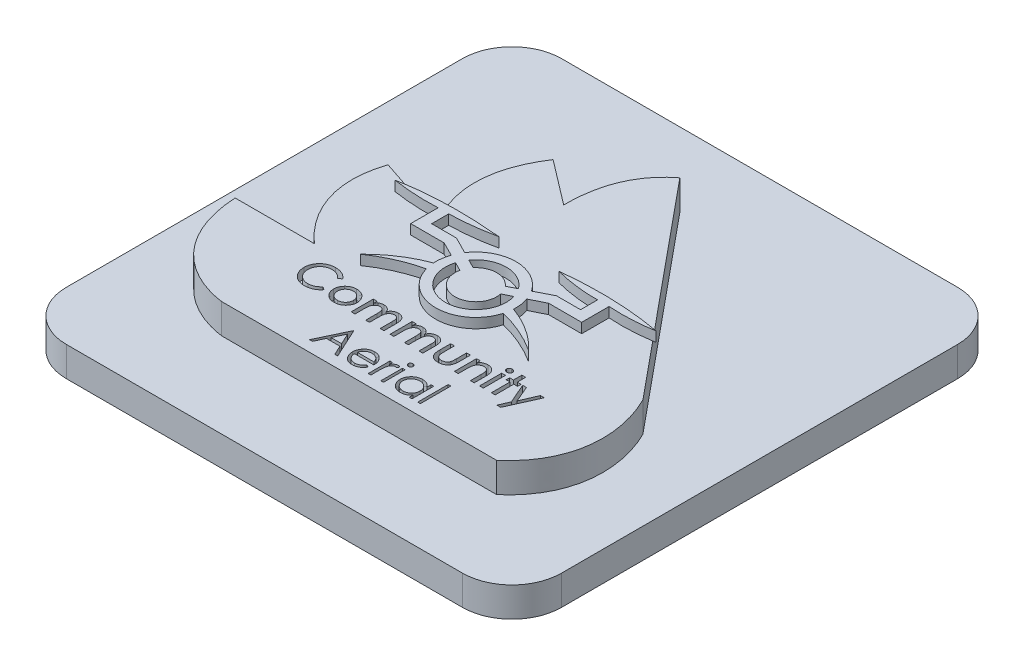
from build123d import *

# Parameters (mm, degrees)
SALIENTE_EXTRUIR1_DEPTH = 3
SALIENTE_EXTRUIR2_DEPTH = 3
SALIENTE_EXTRUIR3_DEPTH = 1
CROQUIS9_W              = 0.384615384
CROQUIS9_H              = 2.230769231
CROQUIS9_W_2            = 0.269230769
CROQUIS9_H_2            = 2.192307693
CROQUIS9_H_3            = 3.076923077
CORTAR_EXTRUIR1_DEPTH   = 1


with BuildPart() as part:
    # Croquis1 → Saliente-Extruir1 (new body)
    with BuildSketch(Plane(origin=(0, 0, 0), x_dir=(1, 0, 0), z_dir=(0, 1, 0))):
        with BuildLine():
            Line((-20, -25), (20, -25))
            ThreePointArc((20, -25), (23.535533906, -23.535533906), (25, -20))
            Line((25, -20), (25, 20))
            ThreePointArc((25, 20), (23.535533906, 23.535533906), (20, 25))
            Line((20, 25), (-20, 25))
            ThreePointArc((-20, 25), (-23.535533906, 23.535533906), (-25, 20))
            Line((-25, 20), (-25, -20))
            ThreePointArc((-25, -20), (-23.535533906, -23.535533906), (-20, -25))
        make_face()
    extrude(amount=SALIENTE_EXTRUIR1_DEPTH)

    # Croquis6 → Saliente-Extruir2 (add)
    with BuildSketch(Plane(origin=(0, 3, 0), x_dir=(1, 0, 0), z_dir=(0, 1, 0))):
        with BuildLine():
            Line((-0.595503629, 17.549236711), (16.965142917, -3.747013148))
            add(Edge.make_bspline(
                [(16.965142917, -3.747013148), (18.872094084, -7.577379746), (19.162143523, -12.703879642), (14.864425621, -16.410366815)],
                knots=[0, 0, 0, 0, 1, 1, 1, 1], degree=3))
            Line((14.864425621, -16.410366815), (-12.915167166, -16.410366815))
            add(Edge.make_bspline(
                [(-12.915167166, -16.410366815), (-17.156158437, -15.818213248), (-20.9540575, -12.712422517), (-21.289806242, -6.66894517)],
                knots=[0, 0, 0, 0, 1, 1, 1, 1], degree=3))
            Line((-21.289806242, -6.66894517), (-13.274385006, -6.66894517))
            add(Edge.make_bspline(
                [(-13.274385006, -6.66894517), (-16.066037219, -4.244615616), (-17.958071864, -0.509342383), (-16.470718627, 3.952717326)],
                knots=[0, 0, 0, 0, 1, 1, 1, 1], degree=3))
            Line((-16.470718627, 3.952717326), (-8.845133153, 1.410855502))
            add(Edge.make_bspline(
                [(-8.845133153, 1.410855502), (-10.96469575, 4.53759804), (-11.330230032, 8.577654893), (-8.59108015, 12.740331995)],
                knots=[0, 0, 0, 0, 1, 1, 1, 1], degree=3))
            Line((-8.59108015, 12.740331995), (-4.083809752, 9.30414951))
            add(Edge.make_bspline(
                [(-4.083809752, 9.30414951), (-4.143667903, 14.820140537), (-0.595503629, 17.549236711)],
                knots=[0, 0, 0, 1, 1, 1], degree=2))
        make_face()
    extrude(amount=SALIENTE_EXTRUIR2_DEPTH)

    # Croquis8 → Saliente-Extruir3 (add)
    with BuildSketch(Plane(origin=(0, 6, 0), x_dir=(1, 0, 0), z_dir=(0, 1, 0))):
        with BuildLine():
            Line((4.752382461, -1.0473555), (3.27665913, -1.777444063))
            ThreePointArc((3.27665913, -1.777444063), (3.461184382, -2.545877663), (3.492924377, -3.335518302))
            add(Edge.make_bspline(
                [(3.492924377, -3.335518302), (6.086272648, -4.275160549), (7.866274911, -6.18313683)],
                knots=[0, 0, 0, 1, 1, 1], degree=2))
            add(Edge.make_bspline(
                [(3.342436036, -4.219780416), (5.735806779, -4.812863994), (7.866274911, -6.18313683)],
                knots=[0, 0, 0, 1, 1, 1], degree=2))
            ThreePointArc((3.342436036, -4.219780416), (-0.549246204, -7.151416377), (-4.440928444, -4.219780416))
            add(Edge.make_bspline(
                [(-4.440928444, -4.219780416), (-6.897374715, -4.776442922), (-9.048256707, -6.256574953)],
                knots=[0, 0, 0, 1, 1, 1], degree=2))
            add(Edge.make_bspline(
                [(-9.048256707, -6.256574953), (-7.086513426, -4.270125847), (-4.591416785, -3.335518302)],
                knots=[0, 0, 0, 1, 1, 1], degree=2))
            ThreePointArc((-4.591416785, -3.335518302), (-4.558844686, -2.539915359), (-4.37119419, -1.766072819))
            Line((-4.37119419, -1.766072819), (-5.802037659, -1.0473555))
            Line((-5.802037659, -1.0473555), (-9.183733575, -1.0473555))
            Line((-9.183733575, -1.0473555), (-9.183733575, 1.721507307))
            add(Edge.make_bspline(
                [(-9.183733575, 1.721507307), (-11.418491387, 1.602185371), (-13.770091581, 1.958048543)],
                knots=[0, 0, 0, 1, 1, 1], degree=2))
            add(Edge.make_bspline(
                [(-13.770091581, 1.958048543), (-10.390702964, 2.616371001), (-6.970911969, 2.565850287), (-3.589204361, 2.263912107)],
                knots=[0, 0, 0, 0, 1, 1, 1, 1], degree=3))
            add(Edge.make_bspline(
                [(-8.114971612, 1.721507307), (-5.815935606, 1.778256872), (-3.589204361, 2.263912107)],
                knots=[0, 0, 0, 1, 1, 1], degree=2))
            Line((-8.114971612, 1.721507307), (-8.114971612, 0))
            Line((-8.114971612, 0), (-5.601123051, 0))
            Line((-5.601123051, 0), (-3.919535783, -0.858752061))
            ThreePointArc((-3.919535783, -0.858752061), (-0.5513851, 0.946341572), (2.818670851, -0.855192476))
            Line((2.818670851, -0.855192476), (4.484377163, 0))
            Line((4.484377163, 0), (6.922960797, 0))
            Line((6.922960797, 0), (6.922960797, 1.721507307))
            add(Edge.make_bspline(
                [(6.922960797, 1.721507307), (4.689578848, 1.689604155), (2.488792555, 2.263912107)],
                knots=[0, 0, 0, 1, 1, 1], degree=2))
            add(Edge.make_bspline(
                [(2.488792555, 2.263912107), (7.62426283, 2.858478497), (12.602813944, 1.958048543)],
                knots=[0, 0, 0, 1, 1, 1], degree=2))
            add(Edge.make_bspline(
                [(12.602813944, 1.958048543), (10.372802055, 1.570256513), (8.082040673, 1.721507307)],
                knots=[0, 0, 0, 1, 1, 1], degree=2))
            Line((8.082040673, 1.721507307), (8.082040673, -1.0473555))
            Line((8.082040673, -1.0473555), (4.752382461, -1.0473555))
        make_face()
        with BuildLine():
            Line((-3.496363092, -2.20550332), (-2.610549432, -2.650450397))
            ThreePointArc((-2.610549432, -2.650450397), (-0.549246204, -5.212834115), (1.512057025, -2.650450397))
            Line((1.512057025, -2.650450397), (2.399639249, -2.211334462))
            ThreePointArc((2.399639249, -2.211334462), (-0.552292925, -6.183147175), (-3.496363092, -2.20550332))
        make_face(mode=Mode.SUBTRACT)
        with BuildLine():
            Line((-3.049614918, -1.303002769), (-2.170673172, -1.751860256))
            ThreePointArc((-2.170673172, -1.751860256), (-0.549246204, -0.992240125), (1.072180764, -1.751860256))
            Line((1.072180764, -1.751860256), (1.949859966, -1.301249819))
            ThreePointArc((1.949859966, -1.301249819), (-0.550326349, -0.021925748), (-3.049614918, -1.303002769))
        make_face(mode=Mode.SUBTRACT)
    extrude(amount=SALIENTE_EXTRUIR3_DEPTH)

    # Croquis9 → Cortar-Extruir1 (cut)
    # profile 1 of 17: a face of its own
    with BuildSketch(Plane(origin=(0, 6, 0), x_dir=(1, 0, 0), z_dir=(0, 1, 0))):
        with BuildLine():
            Line((-8.780017609, -8.323441804), (-9.086507994, -8.534980265))
            add(Edge.make_bspline(
                [(-9.086507994, -8.534980265), (-9.123216671, -8.494771362), (-9.195078289, -8.416057635), (-9.313416623, -8.312947509), (-9.437262649, -8.22616417), (-9.566790752, -8.155996545), (-9.702138073, -8.101066412), (-9.844016551, -8.062899151), (-9.992574412, -8.03937753), (-10.093831734, -8.036464086), (-10.145402225, -8.034980265)],
                knots=[0, 0, 0, 0, 1.078723025, 2.111729107, 3.104379151, 4.071093171, 5.02612831, 5.993405043, 6.978038489, 8, 8, 8, 8], degree=3))
            add(Edge.make_bspline(
                [(-10.145402225, -8.034980265), (-10.17226811, -8.035367503), (-10.225715091, -8.036137874), (-10.304917223, -8.044607563), (-10.382907901, -8.056200203), (-10.459613748, -8.073814024), (-10.534898494, -8.096840804), (-10.609275096, -8.123544869), (-10.681617206, -8.156620514), (-10.752626601, -8.193383886), (-10.821237845, -8.234734533), (-10.885863543, -8.280661792), (-10.947679471, -8.329113469), (-11.004937994, -8.382380364), (-11.05816164, -8.439527623), (-11.108516289, -8.499836097), (-11.154729228, -8.564090228), (-11.196622829, -8.632097388), (-11.2348362, -8.702844289), (-11.266905421, -8.776849442), (-11.294747575, -8.85285741), (-11.31785281, -8.931263977), (-11.334941599, -9.012306635), (-11.347612698, -9.095764785), (-11.355732748, -9.181453568), (-11.356535762, -9.239489416), (-11.356940686, -9.268754304)],
                knots=[0, 0, 0, 0, 1.002068956, 1.993515617, 2.969284448, 3.943018425, 4.926742606, 5.905741285, 6.889351865, 7.892340394, 8.888397413, 9.875523532, 10.849114049, 11.817064186, 12.790109362, 13.76151668, 14.746886598, 15.740472426, 16.740336546, 17.744438579, 18.747064952, 19.759451636, 20.791569268, 21.834966327, 22.908270136, 24, 24, 24, 24], degree=3))
            add(Edge.make_bspline(
                [(-11.356940686, -9.268754304), (-11.35601365, -9.312684206), (-11.354198949, -9.398678325), (-11.33665886, -9.524595348), (-11.309290129, -9.644589886), (-11.270817948, -9.758652461), (-11.221107333, -9.866653498), (-11.160290602, -9.968415564), (-11.088017796, -10.064186784), (-11.005487038, -10.152729244), (-10.915520715, -10.233988377), (-10.818013468, -10.303512788), (-10.71630427, -10.363885577), (-10.608382923, -10.411821013), (-10.495774442, -10.44994477), (-10.377607302, -10.476950172), (-10.254248566, -10.493519794), (-10.170093913, -10.495508947), (-10.127373379, -10.496518727)],
                knots=[0, 0, 0, 0, 1.083728652, 2.12143175, 3.131304262, 4.117911469, 5.086904967, 6.060353746, 7.03835, 8.042493243, 9.043967071, 10.025107856, 10.993520914, 11.958418665, 12.934074928, 13.923564625, 14.94591178, 16, 16, 16, 16], degree=3))
            add(Edge.make_bspline(
                [(-10.127373379, -10.496518727), (-10.077799092, -10.495061476), (-9.979886692, -10.492183313), (-9.835918691, -10.467940419), (-9.69720191, -10.428783864), (-9.563586576, -10.373585333), (-9.434963631, -10.302887199), (-9.311937323, -10.216145868), (-9.193821994, -10.114145698), (-9.122027671, -10.03632349), (-9.085306071, -9.996518727)],
                knots=[0, 0, 0, 0, 0.996377973, 1.967910503, 2.926842387, 3.889624876, 4.868586907, 5.872161968, 6.91164629, 8, 8, 8, 8], degree=3))
            Line((-9.085306071, -9.996518727), (-8.780017609, -10.206855265))
            add(Edge.make_bspline(
                [(-8.780017609, -10.206855265), (-8.799780676, -10.231918179), (-8.839047319, -10.281714931), (-8.902460012, -10.352150505), (-8.969067092, -10.418394883), (-9.039524469, -10.47983361), (-9.113756762, -10.536406926), (-9.191416158, -10.588769891), (-9.272428032, -10.636839219), (-9.356748124, -10.680100535), (-9.443896069, -10.71881997), (-9.534049797, -10.751426269), (-9.626345274, -10.780190366), (-9.721596312, -10.80270947), (-9.819431072, -10.82096057), (-9.920001078, -10.833210813), (-10.022866582, -10.841502259), (-10.092300531, -10.842279812), (-10.127373379, -10.842672573)],
                knots=[0, 0, 0, 0, 0.990136069, 1.967271632, 2.938597646, 3.903378639, 4.8655934, 5.832714132, 6.808088679, 7.786607084, 8.77175572, 9.76479442, 10.759640537, 11.769709565, 12.799869661, 13.846050076, 14.911985293, 16, 16, 16, 16], degree=3))
            add(Edge.make_bspline(
                [(-10.127373379, -10.842672573), (-10.159639724, -10.842453903), (-10.223242543, -10.842022865), (-10.317237945, -10.834780626), (-10.408742518, -10.824987439), (-10.497509613, -10.81029528), (-10.583958092, -10.792701209), (-10.667382335, -10.769373567), (-10.748914173, -10.743351969), (-10.827367313, -10.711882482), (-10.903333288, -10.676886868), (-10.977079336, -10.638532283), (-11.047879945, -10.595256384), (-11.115794048, -10.547479489), (-11.181621046, -10.496404347), (-11.244695172, -10.440893753), (-11.305672694, -10.381654588), (-11.343387202, -10.338918888), (-11.36234934, -10.317432188)],
                knots=[0, 0, 0, 0, 1.116169561, 2.200172621, 3.260333751, 4.299600589, 5.312386579, 6.311224183, 7.295427787, 8.272379731, 9.233840239, 10.188782295, 11.146938977, 12.102635432, 13.060741968, 14.028403985, 15.00871894, 16, 16, 16, 16], degree=3))
            add(Edge.make_bspline(
                [(-11.36234934, -10.317432188), (-11.392746353, -10.28012577), (-11.452998288, -10.206178242), (-11.529790339, -10.085980448), (-11.596025452, -9.96087943), (-11.648651873, -9.82909281), (-11.690248858, -9.692174815), (-11.720567279, -9.549707658), (-11.738036351, -9.401204006), (-11.740369724, -9.300250148), (-11.741556071, -9.248922573)],
                knots=[0, 0, 0, 0, 0.995996121, 1.974230005, 2.94855815, 3.923972302, 4.908363682, 5.909282248, 6.937024559, 8, 8, 8, 8], degree=3))
            add(Edge.make_bspline(
                [(-11.741556071, -9.248922573), (-11.740216738, -9.194963238), (-11.737581684, -9.088801614), (-11.715389632, -8.932959943), (-11.679230419, -8.783882255), (-11.629530533, -8.640925245), (-11.563673092, -8.505258517), (-11.485134432, -8.375128977), (-11.390154065, -8.252961274), (-11.283405928, -8.137697477), (-11.165960628, -8.032210499), (-11.03912857, -7.940736228), (-10.905618228, -7.862566887), (-10.764937921, -7.798531895), (-10.61670646, -7.748925235), (-10.461168899, -7.714607113), (-10.298658732, -7.692876738), (-10.187940187, -7.6901927), (-10.131580109, -7.688826419)],
                knots=[0, 0, 0, 0, 1.034323922, 2.034967744, 3.011348252, 3.972313581, 4.931003742, 5.898099022, 6.881526582, 7.89265862, 8.907395938, 9.903191422, 10.886146247, 11.869423756, 12.861842533, 13.877618994, 14.91962492, 16, 16, 16, 16], degree=3))
            add(Edge.make_bspline(
                [(-10.131580109, -7.688826419), (-10.096109008, -7.68923714), (-10.02587954, -7.690050328), (-9.92175631, -7.698085011), (-9.820275426, -7.711273198), (-9.721416623, -7.729439294), (-9.624887294, -7.751887159), (-9.531198318, -7.781157268), (-9.439818822, -7.814594629), (-9.351363905, -7.853199763), (-9.266050625, -7.896146134), (-9.184846193, -7.944595142), (-9.107189503, -7.996687299), (-9.033699549, -8.053508373), (-8.963886506, -8.114121499), (-8.898091329, -8.179224332), (-8.836656821, -8.249080902), (-8.79896056, -8.298571845), (-8.780017609, -8.323441804)],
                knots=[0, 0, 0, 0, 1.097463626, 2.172875475, 3.229307817, 4.262776093, 5.282168658, 6.293918414, 7.298043722, 8.291879901, 9.278790577, 10.251524626, 11.216027204, 12.170719329, 13.124142787, 14.075306658, 15.032812027, 16, 16, 16, 16], degree=3))
        make_face()
    # profile 2 of 17: a face of its own
    with BuildSketch(Plane(origin=(0, 6, 0), x_dir=(1, 0, 0), z_dir=(0, 1, 0))):
        with BuildLine():
            add(Edge.make_bspline(
                [(-7.18266184, -8.496518727), (-7.138141889, -8.4977379), (-7.050980228, -8.500124811), (-6.923439736, -8.516917861), (-6.802327086, -8.546095217), (-6.687295159, -8.586029752), (-6.578817369, -8.638349564), (-6.476622777, -8.7016475), (-6.381076755, -8.777154363), (-6.323523405, -8.835051), (-6.294440686, -8.864307188)],
                knots=[0, 0, 0, 0, 1.078775739, 2.112039281, 3.110494877, 4.093081892, 5.057110616, 6.022958758, 7.000966324, 8, 8, 8, 8], degree=3))
            add(Edge.make_bspline(
                [(-6.294440686, -8.864307188), (-6.268650233, -8.893305251), (-6.217944192, -8.950317704), (-6.152426495, -9.042281496), (-6.096630139, -9.136883691), (-6.051489389, -9.234837496), (-6.015508951, -9.335694987), (-5.990556256, -9.439854686), (-5.974842934, -9.547119543), (-5.973171314, -9.619661016), (-5.972325302, -9.656374496)],
                knots=[0, 0, 0, 0, 1.062178036, 2.088324843, 3.086640365, 4.066023852, 5.037709567, 6.014384934, 6.995073642, 8, 8, 8, 8], degree=3))
            add(Edge.make_bspline(
                [(-5.972325302, -9.656374496), (-5.973382694, -9.693290557), (-5.975478299, -9.766453059), (-5.991699485, -9.874529672), (-6.017353586, -9.979727549), (-6.054257714, -10.081566431), (-6.101752463, -10.180156815), (-6.158731686, -10.276098421), (-6.227430341, -10.36811429), (-6.304671685, -10.456471213), (-6.39050869, -10.537984264), (-6.48418532, -10.609348161), (-6.584553176, -10.669741012), (-6.691431025, -10.719452663), (-6.805328582, -10.757016462), (-6.925142497, -10.784834803), (-7.05179713, -10.80126333), (-7.138342544, -10.80321275), (-7.18266184, -10.804211034)],
                knots=[0, 0, 0, 0, 0.952871876, 1.888459614, 2.815544184, 3.744891397, 4.679563604, 5.637601804, 6.621431805, 7.640342292, 8.664856555, 9.672479278, 10.67487095, 11.683873433, 12.709444777, 13.765907845, 14.855937143, 16, 16, 16, 16], degree=3))
            add(Edge.make_bspline(
                [(-7.18266184, -10.804211034), (-7.224988738, -10.803238869), (-7.307961711, -10.801333145), (-7.429210602, -10.784414477), (-7.544830347, -10.758594682), (-7.653977766, -10.720182381), (-7.757552009, -10.672147045), (-7.854860212, -10.612568761), (-7.946651882, -10.542864944), (-8.030532541, -10.462217281), (-8.10698733, -10.375518149), (-8.173348864, -10.283475517), (-8.230426037, -10.188229287), (-8.276828956, -10.088973816), (-8.31238818, -9.98574479), (-8.338424381, -9.879394099), (-8.353628451, -9.768991509), (-8.355825795, -9.694281129), (-8.356940686, -9.656374496)],
                knots=[0, 0, 0, 0, 1.108842573, 2.173652473, 3.202745058, 4.208988794, 5.200203338, 6.189803525, 7.193715926, 8.215010613, 9.234454675, 10.219573757, 11.184848795, 12.140854958, 13.08565054, 14.042002664, 15.006549187, 16, 16, 16, 16], degree=3))
            add(Edge.make_bspline(
                [(-8.356940686, -9.656374496), (-8.356032661, -9.618870569), (-8.354243672, -9.54498041), (-8.339578728, -9.436031243), (-8.31469686, -9.331347047), (-8.281154333, -9.230080626), (-8.236861623, -9.133003038), (-8.183013094, -9.039566503), (-8.120095704, -8.949426036), (-8.071050697, -8.894096124), (-8.046243571, -8.866110073)],
                knots=[0, 0, 0, 0, 1.034079547, 2.037341334, 3.024980457, 3.998111168, 4.974764182, 5.962233312, 6.969290918, 8, 8, 8, 8], degree=3))
            add(Edge.make_bspline(
                [(-8.046243571, -8.866110073), (-8.017384405, -8.836629739), (-7.960490217, -8.778510955), (-7.865790529, -8.70316005), (-7.765877442, -8.63891334), (-7.659745763, -8.587252089), (-7.548634118, -8.545743656), (-7.431450794, -8.51713622), (-7.308763629, -8.500129671), (-7.22518422, -8.497736362), (-7.18266184, -8.496518727)],
                knots=[0, 0, 0, 0, 1.021997278, 2.014808882, 2.992991082, 3.961403697, 4.935644248, 5.92819495, 6.945935601, 8, 8, 8, 8], degree=3))
        make_face()
        with BuildLine():
            add(Edge.make_bspline(
                [(-7.183863763, -8.842672573), (-7.209543196, -8.843356852), (-7.260531079, -8.844715526), (-7.335632057, -8.855833448), (-7.40862688, -8.873812149), (-7.478714549, -8.899914169), (-7.546952974, -8.932533815), (-7.612195333, -8.973162926), (-7.675912008, -9.020152601), (-7.735783407, -9.074565378), (-7.791487769, -9.133801637), (-7.839751095, -9.198041388), (-7.88103902, -9.265483488), (-7.91410461, -9.336979227), (-7.940230298, -9.412043265), (-7.958510832, -9.49081983), (-7.970559622, -9.573271851), (-7.971728676, -9.629487663), (-7.972325302, -9.65817738)],
                knots=[0, 0, 0, 0, 0.976916649, 1.939720157, 2.882730922, 3.833047911, 4.780976627, 5.756404754, 6.753607, 7.790049989, 8.831165002, 9.84360893, 10.842529111, 11.835057585, 12.835634664, 13.861933882, 14.908838789, 16, 16, 16, 16], degree=3))
            add(Edge.make_bspline(
                [(-7.972325302, -9.65817738), (-7.970959252, -9.69554293), (-7.96827083, -9.769079324), (-7.946302535, -9.876791459), (-7.911437675, -9.979732009), (-7.862759103, -10.076557763), (-7.803251054, -10.165142052), (-7.73388513, -10.242692759), (-7.657313591, -10.309827198), (-7.572058126, -10.363738701), (-7.481041812, -10.405934699), (-7.38549649, -10.435974339), (-7.285960928, -10.454748538), (-7.218201579, -10.456944407), (-7.183863763, -10.458057188)],
                knots=[0, 0, 0, 0, 1.073737222, 2.11314337, 3.147909503, 4.191315005, 5.220292011, 6.207728104, 7.175628903, 8.139268678, 9.098074859, 10.052770626, 11.013219503, 12, 12, 12, 12], degree=3))
            add(Edge.make_bspline(
                [(-7.183863763, -10.458057188), (-7.146718359, -10.45678802), (-7.073521375, -10.454287058), (-6.966314336, -10.434409724), (-6.86393185, -10.402494376), (-6.767091322, -10.358013698), (-6.677218247, -10.301662761), (-6.596852849, -10.233272148), (-6.526419493, -10.153975663), (-6.466110781, -10.065587466), (-6.417408912, -9.969685815), (-6.382443601, -9.869037293), (-6.361235252, -9.764628093), (-6.358383141, -9.693931956), (-6.356940686, -9.65817738)],
                knots=[0, 0, 0, 0, 1.042880454, 2.055051067, 3.051726387, 4.048830532, 5.040201766, 6.022282375, 7.002717173, 8.011000956, 9.020163719, 10.014978664, 10.996075346, 12, 12, 12, 12], degree=3))
            add(Edge.make_bspline(
                [(-6.356940686, -9.65817738), (-6.35756745, -9.630492366), (-6.358803825, -9.575879968), (-6.370604384, -9.495530031), (-6.389756466, -9.418159682), (-6.416971955, -9.344114476), (-6.451436226, -9.273136833), (-6.493840266, -9.205529335), (-6.544033842, -9.140969721), (-6.601253426, -9.080502871), (-6.663279915, -9.0249063), (-6.728818958, -8.975808077), (-6.797736056, -8.935030269), (-6.869076008, -8.900666415), (-6.943845132, -8.875131031), (-7.021275027, -8.856423446), (-7.101563451, -8.844511199), (-7.156177774, -8.84329109), (-7.183863763, -8.842672573)],
                knots=[0, 0, 0, 0, 1.02928639, 2.030405262, 3.013559112, 3.98951401, 4.959304921, 5.943474834, 6.952548865, 7.996299005, 9.035918103, 10.047849461, 11.03697177, 12.01024899, 12.98822153, 13.969594738, 14.97071361, 16, 16, 16, 16], degree=3))
        make_face(mode=Mode.SUBTRACT)
    # profile 3 of 17: a face of its own
    with BuildSketch(Plane(origin=(0, 6, 0), x_dir=(1, 0, 0), z_dir=(0, 1, 0))):
        with BuildLine():
            Line((-5.472325302, -8.534980265), (-5.087709917, -8.534980265))
            Line((-5.087709917, -8.534980265), (-5.087709917, -8.909379304))
            add(Edge.make_bspline(
                [(-5.087709917, -8.909379304), (-5.084016013, -8.89326829), (-5.076808613, -8.861833121), (-5.060937764, -8.816973874), (-5.04154889, -8.775492132), (-5.019481438, -8.736396703), (-4.992665946, -8.701204043), (-4.963333613, -8.668132788), (-4.929374477, -8.63939978), (-4.904771522, -8.622704242), (-4.892397417, -8.614307188)],
                knots=[0, 0, 0, 0, 1.08898891, 2.124791909, 3.129224238, 4.105481065, 5.077441123, 6.040388005, 7.014409297, 8, 8, 8, 8], degree=3))
            add(Edge.make_bspline(
                [(-4.892397417, -8.614307188), (-4.855151485, -8.596061415), (-4.781610758, -8.560035805), (-4.665298475, -8.524250055), (-4.547623494, -8.500407475), (-4.468235826, -8.497816866), (-4.428455109, -8.496518727)],
                knots=[0, 0, 0, 0, 1.028471117, 2.030678542, 3.013184023, 4, 4, 4, 4], degree=3))
            add(Edge.make_bspline(
                [(-4.428455109, -8.496518727), (-4.399157144, -8.497264885), (-4.341057022, -8.498744575), (-4.255028739, -8.512539941), (-4.171477044, -8.534715387), (-4.091189939, -8.56532078), (-4.016290312, -8.602873282), (-3.947905248, -8.645305959), (-3.88770983, -8.693409551), (-3.834930045, -8.74607896), (-3.79107363, -8.805128757), (-3.756490052, -8.869788663), (-3.731955536, -8.940864482), (-3.723606506, -8.990744389), (-3.719320494, -9.016350457)],
                knots=[0, 0, 0, 0, 1.099015544, 2.179432478, 3.260947688, 4.338981182, 5.398181099, 6.40160478, 7.353922011, 8.284349489, 9.192639792, 10.104191918, 11.026778618, 12, 12, 12, 12], degree=3))
            add(Edge.make_bspline(
                [(-3.719320494, -9.016350457), (-3.712378721, -8.996617451), (-3.698652022, -8.9575973), (-3.673550861, -8.901382284), (-3.643144338, -8.848912433), (-3.60875851, -8.799486659), (-3.570385362, -8.752800704), (-3.52665645, -8.710479702), (-3.479812338, -8.67016184), (-3.428154325, -8.634819581), (-3.37442073, -8.602398866), (-3.318976893, -8.574135021), (-3.26265783, -8.549912203), (-3.205009692, -8.530878309), (-3.146772541, -8.514858284), (-3.08704638, -8.504083148), (-3.02632974, -8.498216478), (-2.985558114, -8.497085726), (-2.965113763, -8.496518727)],
                knots=[0, 0, 0, 0, 1.024672991, 2.026193794, 3.01103273, 3.991165591, 4.973850373, 5.96628909, 6.969107479, 7.9982829, 9.028393851, 10.042340945, 11.044967205, 12.028827566, 13.014448664, 14.002022455, 14.998142625, 16, 16, 16, 16], degree=3))
            add(Edge.make_bspline(
                [(-2.965113763, -8.496518727), (-2.944263083, -8.496791748), (-2.903272055, -8.497328491), (-2.842876971, -8.503753123), (-2.784379607, -8.513117028), (-2.727868989, -8.526872622), (-2.673549671, -8.545143357), (-2.621161056, -8.566847662), (-2.570444871, -8.59185681), (-2.507037105, -8.631305812), (-2.433120765, -8.686352925), (-2.358121003, -8.76582762), (-2.295262863, -8.854381204), (-2.254422375, -8.936897615), (-2.228401989, -9.009310599), (-2.210918861, -9.070093821), (-2.196868301, -9.137039956), (-2.184707721, -9.209786722), (-2.175989222, -9.288853134), (-2.169535994, -9.373838558), (-2.16508577, -9.465021738), (-2.164787366, -9.527763104), (-2.164632994, -9.56022065)],
                knots=[0, 0, 0, 0, 0.823429448, 1.618806632, 2.396867138, 3.162757021, 3.913573328, 4.658737237, 5.40200746, 6.144476677, 7.607081062, 9.028926194, 10.443018941, 11.88355177, 12.649646081, 13.481287888, 14.380074908, 15.350698398, 16.394246037, 17.521443358, 18.717785893, 20, 20, 20, 20], degree=3))
            Line((-2.164632994, -9.56022065), (-2.164632994, -10.765749496))
            Line((-2.164632994, -10.765749496), (-2.549248379, -10.765749496))
            Line((-2.549248379, -10.765749496), (-2.549248379, -9.561422573))
            add(Edge.make_bspline(
                [(-2.549248379, -9.561422573), (-2.549296532, -9.534577318), (-2.549388909, -9.483078183), (-2.551927681, -9.409346187), (-2.555493771, -9.342424297), (-2.55999048, -9.282250027), (-2.566635688, -9.22873563), (-2.574390681, -9.181816006), (-2.582849473, -9.14144836), (-2.597421291, -9.097318569), (-2.620188558, -9.049081332), (-2.655754538, -8.997562787), (-2.69947036, -8.952214471), (-2.750775974, -8.913251837), (-2.808349795, -8.880926848), (-2.872557277, -8.859125656), (-2.941618897, -8.844532826), (-2.989673084, -8.843304457), (-3.014392609, -8.842672573)],
                knots=[0, 0, 0, 0, 1.305376404, 2.504195096, 3.587062772, 4.564309401, 5.437885818, 6.208191464, 6.877018247, 7.440755119, 8.464755235, 9.459136026, 10.471907885, 11.51427718, 12.582498913, 13.666986569, 14.799875944, 16, 16, 16, 16], degree=3))
            add(Edge.make_bspline(
                [(-3.014392609, -8.842672573), (-3.041935791, -8.84401553), (-3.097087689, -8.84670464), (-3.178540261, -8.866390089), (-3.256735838, -8.900420531), (-3.331792606, -8.945790736), (-3.400698936, -9.003489849), (-3.461732237, -9.072072911), (-3.512087073, -9.152257174), (-3.547646692, -9.226784783), (-3.570603161, -9.294929929), (-3.585098274, -9.355345414), (-3.598621821, -9.423832813), (-3.608101474, -9.500997823), (-3.616989572, -9.58650369), (-3.621653004, -9.680577108), (-3.625639081, -9.783143356), (-3.6259891, -9.854286089), (-3.626171456, -9.891350457)],
                knots=[0, 0, 0, 0, 0.96585306, 1.934004254, 2.919496243, 3.947541218, 5.000269242, 6.060662749, 7.154254566, 8.311133038, 8.948925841, 9.673294331, 10.489200144, 11.396606791, 12.399336697, 13.504450846, 14.699853812, 16, 16, 16, 16], degree=3))
            Line((-3.626171456, -9.891350457), (-3.626171456, -10.765749496))
            Line((-3.626171456, -10.765749496), (-4.01078684, -10.765749496))
            Line((-4.01078684, -10.765749496), (-4.01078684, -9.634138919))
            add(Edge.make_bspline(
                [(-4.01078684, -9.634138919), (-4.010833744, -9.603888458), (-4.010923531, -9.545980875), (-4.013468908, -9.463035749), (-4.017047801, -9.387703147), (-4.021480178, -9.320120723), (-4.028126482, -9.260393649), (-4.035952417, -9.208483819), (-4.044285713, -9.164101929), (-4.058830622, -9.116278414), (-4.081066319, -9.063869905), (-4.116766037, -9.008340722), (-4.160764117, -8.959368063), (-4.212682799, -8.918058047), (-4.270869503, -8.884224938), (-4.334997887, -8.86000767), (-4.404344087, -8.845214415), (-4.452418145, -8.843535633), (-4.477132994, -8.842672573)],
                knots=[0, 0, 0, 0, 1.376972876, 2.63589934, 3.777064908, 4.810071307, 5.718390574, 6.511518754, 7.200035386, 7.771255398, 8.78422519, 9.780850683, 10.762300705, 11.767731362, 12.789080549, 13.813681154, 14.876014565, 16, 16, 16, 16], degree=3))
            add(Edge.make_bspline(
                [(-4.477132994, -8.842672573), (-4.503473167, -8.844061634), (-4.556396256, -8.846852557), (-4.63490335, -8.866056371), (-4.711463335, -8.898923845), (-4.785929574, -8.942932866), (-4.855815684, -8.998522677), (-4.917246377, -9.066439215), (-4.969565882, -9.145318834), (-5.005743635, -9.219405378), (-5.029529796, -9.28592501), (-5.044724841, -9.34331436), (-5.058825174, -9.40697491), (-5.069205902, -9.477496463), (-5.077601344, -9.554474764), (-5.083449438, -9.638071258), (-5.087084354, -9.728256904), (-5.087496585, -9.790585506), (-5.087709917, -9.822840842)],
                knots=[0, 0, 0, 0, 0.973948812, 1.956873266, 2.969584629, 4.045778838, 5.147278558, 6.259119363, 7.418022777, 8.637370586, 9.298195669, 10.027900773, 10.831491835, 11.708502133, 12.662464834, 13.694928854, 14.807115174, 16, 16, 16, 16], degree=3))
            Line((-5.087709917, -9.822840842), (-5.087709917, -10.765749496))
            Line((-5.087709917, -10.765749496), (-5.472325302, -10.765749496))
            Line((-5.472325302, -10.765749496), (-5.472325302, -8.534980265))
        make_face()
    # profile 4 of 17: a face of its own
    with BuildSketch(Plane(origin=(0, 6, 0), x_dir=(1, 0, 0), z_dir=(0, 1, 0))):
        with BuildLine():
            Line((-1.549248379, -8.534980265), (-1.164632994, -8.534980265))
            Line((-1.164632994, -8.534980265), (-1.164632994, -8.909379304))
            add(Edge.make_bspline(
                [(-1.164632994, -8.909379304), (-1.16093909, -8.89326829), (-1.15373169, -8.861833121), (-1.137860841, -8.816973874), (-1.118471967, -8.775492132), (-1.096404515, -8.736396703), (-1.069589023, -8.701204043), (-1.04025669, -8.668132788), (-1.006297554, -8.63939978), (-0.981694599, -8.622704242), (-0.969320494, -8.614307188)],
                knots=[0, 0, 0, 0, 1.08898891, 2.124791909, 3.129224238, 4.105481065, 5.077441123, 6.040388005, 7.014409297, 8, 8, 8, 8], degree=3))
            add(Edge.make_bspline(
                [(-0.969320494, -8.614307188), (-0.932074562, -8.596061415), (-0.858533835, -8.560035805), (-0.742221552, -8.524250055), (-0.624546571, -8.500407475), (-0.545158903, -8.497816866), (-0.505378186, -8.496518727)],
                knots=[0, 0, 0, 0, 1.028471117, 2.030678542, 3.013184023, 4, 4, 4, 4], degree=3))
            add(Edge.make_bspline(
                [(-0.505378186, -8.496518727), (-0.476080221, -8.497264885), (-0.417980099, -8.498744575), (-0.331951816, -8.512539941), (-0.248400121, -8.534715387), (-0.168113016, -8.56532078), (-0.093213389, -8.602873282), (-0.024828325, -8.645305959), (0.035367093, -8.693409551), (0.088146878, -8.74607896), (0.132003293, -8.805128757), (0.166586871, -8.869788663), (0.191121387, -8.940864482), (0.199470417, -8.990744389), (0.203756429, -9.016350457)],
                knots=[0, 0, 0, 0, 1.099015544, 2.179432478, 3.260947688, 4.338981182, 5.398181099, 6.40160478, 7.353922011, 8.284349489, 9.192639792, 10.104191918, 11.026778618, 12, 12, 12, 12], degree=3))
            add(Edge.make_bspline(
                [(0.203756429, -9.016350457), (0.210698202, -8.996617451), (0.224424901, -8.9575973), (0.249526062, -8.901382284), (0.279932585, -8.848912433), (0.314318413, -8.799486659), (0.352691561, -8.752800704), (0.396420473, -8.710479702), (0.443264585, -8.67016184), (0.494922598, -8.634819581), (0.548656194, -8.602398866), (0.60410003, -8.574135021), (0.660419094, -8.549912203), (0.718067231, -8.530878309), (0.776304382, -8.514858284), (0.836030543, -8.504083148), (0.896747183, -8.498216478), (0.937518809, -8.497085726), (0.95796316, -8.496518727)],
                knots=[0, 0, 0, 0, 1.024672991, 2.026193794, 3.01103273, 3.991165591, 4.973850373, 5.96628909, 6.969107479, 7.9982829, 9.028393851, 10.042340945, 11.044967205, 12.028827566, 13.014448664, 14.002022455, 14.998142625, 16, 16, 16, 16], degree=3))
            add(Edge.make_bspline(
                [(0.95796316, -8.496518727), (0.97881384, -8.496791748), (1.019804868, -8.497328491), (1.080199952, -8.503753123), (1.138697316, -8.513117028), (1.195207934, -8.526872622), (1.249527252, -8.545143357), (1.301915867, -8.566847662), (1.352632052, -8.59185681), (1.416039818, -8.631305812), (1.489956158, -8.686352925), (1.564955921, -8.76582762), (1.62781406, -8.854381204), (1.668654548, -8.936897615), (1.694674934, -9.009310599), (1.712158062, -9.070093821), (1.726208622, -9.137039956), (1.738369202, -9.209786722), (1.747087701, -9.288853134), (1.753540929, -9.373838558), (1.757991153, -9.465021738), (1.758289557, -9.527763104), (1.758443929, -9.56022065)],
                knots=[0, 0, 0, 0, 0.823429448, 1.618806632, 2.396867138, 3.162757021, 3.913573328, 4.658737237, 5.40200746, 6.144476677, 7.607081062, 9.028926194, 10.443018941, 11.88355177, 12.649646081, 13.481287888, 14.380074908, 15.350698398, 16.394246037, 17.521443358, 18.717785893, 20, 20, 20, 20], degree=3))
            Line((1.758443929, -9.56022065), (1.758443929, -10.765749496))
            Line((1.758443929, -10.765749496), (1.373828544, -10.765749496))
            Line((1.373828544, -10.765749496), (1.373828544, -9.561422573))
            add(Edge.make_bspline(
                [(1.373828544, -9.561422573), (1.373780391, -9.534577318), (1.373688014, -9.483078183), (1.371149242, -9.409346187), (1.367583152, -9.342424297), (1.363086443, -9.282250027), (1.356441235, -9.22873563), (1.348686242, -9.181816006), (1.34022745, -9.14144836), (1.325655632, -9.097318569), (1.302888365, -9.049081332), (1.267322385, -8.997562787), (1.223606563, -8.952214471), (1.172300949, -8.913251837), (1.114727128, -8.880926848), (1.050519646, -8.859125656), (0.981458026, -8.844532826), (0.933403839, -8.843304457), (0.908684314, -8.842672573)],
                knots=[0, 0, 0, 0, 1.305376404, 2.504195096, 3.587062772, 4.564309401, 5.437885818, 6.208191464, 6.877018247, 7.440755119, 8.464755235, 9.459136026, 10.471907885, 11.51427718, 12.582498913, 13.666986569, 14.799875944, 16, 16, 16, 16], degree=3))
            add(Edge.make_bspline(
                [(0.908684314, -8.842672573), (0.881141132, -8.84401553), (0.825989234, -8.84670464), (0.744536663, -8.866390089), (0.666341085, -8.900420531), (0.591284317, -8.945790736), (0.522377987, -9.003489849), (0.461344686, -9.072072911), (0.41098985, -9.152257174), (0.375430231, -9.226784783), (0.352473762, -9.294929929), (0.337978649, -9.355345414), (0.324455102, -9.423832813), (0.314975449, -9.500997823), (0.306087351, -9.58650369), (0.301423919, -9.680577108), (0.297437842, -9.783143356), (0.297087823, -9.854286089), (0.296905467, -9.891350457)],
                knots=[0, 0, 0, 0, 0.96585306, 1.934004254, 2.919496243, 3.947541218, 5.000269242, 6.060662749, 7.154254566, 8.311133038, 8.948925841, 9.673294331, 10.489200144, 11.396606791, 12.399336697, 13.504450846, 14.699853812, 16, 16, 16, 16], degree=3))
            Line((0.296905467, -9.891350457), (0.296905467, -10.765749496))
            Line((0.296905467, -10.765749496), (-0.087709917, -10.765749496))
            Line((-0.087709917, -10.765749496), (-0.087709917, -9.634138919))
            add(Edge.make_bspline(
                [(-0.087709917, -9.634138919), (-0.087756821, -9.603888458), (-0.087846608, -9.545980875), (-0.090391985, -9.463035749), (-0.093970878, -9.387703147), (-0.098403255, -9.320120723), (-0.105049559, -9.260393649), (-0.112875494, -9.208483819), (-0.12120879, -9.164101929), (-0.135753699, -9.116278414), (-0.157989396, -9.063869905), (-0.193689114, -9.008340722), (-0.237687194, -8.959368063), (-0.289605876, -8.918058047), (-0.34779258, -8.884224938), (-0.411920964, -8.86000767), (-0.481267164, -8.845214415), (-0.529341222, -8.843535633), (-0.554056071, -8.842672573)],
                knots=[0, 0, 0, 0, 1.376972876, 2.63589934, 3.777064908, 4.810071307, 5.718390574, 6.511518754, 7.200035386, 7.771255398, 8.78422519, 9.780850683, 10.762300705, 11.767731362, 12.789080549, 13.813681154, 14.876014565, 16, 16, 16, 16], degree=3))
            add(Edge.make_bspline(
                [(-0.554056071, -8.842672573), (-0.580396244, -8.844061634), (-0.633319333, -8.846852557), (-0.711826427, -8.866056371), (-0.788386412, -8.898923845), (-0.862852651, -8.942932866), (-0.932738761, -8.998522677), (-0.994169454, -9.066439215), (-1.046488959, -9.145318834), (-1.082666712, -9.219405378), (-1.106452872, -9.28592501), (-1.121647918, -9.34331436), (-1.135748251, -9.40697491), (-1.146128979, -9.477496463), (-1.154524421, -9.554474764), (-1.160372515, -9.638071258), (-1.164007431, -9.728256904), (-1.164419662, -9.790585506), (-1.164632994, -9.822840842)],
                knots=[0, 0, 0, 0, 0.973948812, 1.956873266, 2.969584629, 4.045778838, 5.147278558, 6.259119363, 7.418022777, 8.637370586, 9.298195669, 10.027900773, 10.831491835, 11.708502133, 12.662464834, 13.694928854, 14.807115174, 16, 16, 16, 16], degree=3))
            Line((-1.164632994, -9.822840842), (-1.164632994, -10.765749496))
            Line((-1.164632994, -10.765749496), (-1.549248379, -10.765749496))
            Line((-1.549248379, -10.765749496), (-1.549248379, -8.534980265))
        make_face()
    # profile 5 of 17: a face of its own
    with BuildSketch(Plane(origin=(0, 6, 0), x_dir=(1, 0, 0), z_dir=(0, 1, 0))):
        with BuildLine():
            Line((2.335367006, -8.534980265), (2.719982391, -8.534980265))
            Line((2.719982391, -8.534980265), (2.719982391, -9.570436996))
            add(Edge.make_bspline(
                [(2.719982391, -9.570436996), (2.720095275, -9.599684278), (2.720311788, -9.655781052), (2.722008439, -9.73632956), (2.725246293, -9.809231069), (2.728255269, -9.874624595), (2.734121452, -9.932265506), (2.739474948, -9.982716732), (2.747264687, -10.025419118), (2.753719829, -10.051033115), (2.756641044, -10.062624496)],
                knots=[0, 0, 0, 0, 1.418944939, 2.721560048, 3.90822129, 4.959445687, 5.896519748, 6.718644391, 7.420134194, 8, 8, 8, 8], degree=3))
            add(Edge.make_bspline(
                [(2.756641044, -10.062624496), (2.767623189, -10.093736113), (2.788851012, -10.153872994), (2.8371831, -10.234717972), (2.895520705, -10.304295805), (2.965861425, -10.360388583), (3.044322723, -10.404829202), (3.130801193, -10.434744239), (3.223227831, -10.455310968), (3.287371055, -10.457124809), (3.320342967, -10.458057188)],
                knots=[0, 0, 0, 0, 1.064698082, 2.057997224, 3.027713519, 3.985869738, 4.951769774, 5.929245647, 6.93555818, 8, 8, 8, 8], degree=3))
            add(Edge.make_bspline(
                [(3.320342967, -10.458057188), (3.356294752, -10.45684106), (3.425743593, -10.454491838), (3.525608819, -10.434921225), (3.616994262, -10.402733544), (3.698241258, -10.356259435), (3.770236403, -10.300982453), (3.829348035, -10.235482134), (3.878794756, -10.163486579), (3.899867893, -10.109607371), (3.910487198, -10.082456227)],
                knots=[0, 0, 0, 0, 1.152522955, 2.226353534, 3.250900004, 4.246517978, 5.217118907, 6.149589309, 7.067529598, 8, 8, 8, 8], degree=3))
            add(Edge.make_bspline(
                [(3.910487198, -10.082456227), (3.913930295, -10.07109407), (3.921571214, -10.045879176), (3.928391469, -10.002818729), (3.936103767, -9.95183619), (3.940779611, -9.891979141), (3.946025093, -9.823715852), (3.948571175, -9.746733451), (3.950473855, -9.661392966), (3.950656183, -9.601688609), (3.950751621, -9.570436996)],
                knots=[0, 0, 0, 0, 0.552623276, 1.226381414, 2.027670893, 2.955584593, 4.022320098, 5.218031084, 6.543807858, 8, 8, 8, 8], degree=3))
            Line((3.950751621, -9.570436996), (3.950751621, -8.534980265))
            Line((3.950751621, -8.534980265), (4.335367006, -8.534980265))
            Line((4.335367006, -8.534980265), (4.335367006, -9.62272065))
            add(Edge.make_bspline(
                [(4.335367006, -9.62272065), (4.334972686, -9.658381138), (4.334205831, -9.72773207), (4.329686755, -9.828400522), (4.320965064, -9.922567082), (4.310382652, -10.010204076), (4.29403776, -10.091003741), (4.276793686, -10.165537723), (4.254979421, -10.233428003), (4.229611014, -10.29530337), (4.200509697, -10.35230347), (4.167666035, -10.405546519), (4.131539357, -10.456314295), (4.091509784, -10.504297953), (4.04708538, -10.548858302), (3.999669104, -10.59126824), (3.947809072, -10.630140345), (3.892531445, -10.666292745), (3.833451885, -10.699041461), (3.770365734, -10.726913359), (3.704057882, -10.751361449), (3.633735548, -10.770202305), (3.560008062, -10.786098771), (3.482465323, -10.796727715), (3.401364172, -10.802598939), (3.346193763, -10.803665045), (3.317939121, -10.804211034)],
                knots=[0, 0, 0, 0, 1.433126784, 2.78708125, 4.047948649, 5.23317835, 6.332013834, 7.359028814, 8.306074614, 9.194073739, 10.043734443, 10.874888521, 11.705886645, 12.545920784, 13.382708552, 14.23240739, 15.100217466, 15.98441358, 16.885165303, 17.811245298, 18.753488952, 19.72218431, 20.734230158, 21.782757764, 22.864474903, 24, 24, 24, 24], degree=3))
            add(Edge.make_bspline(
                [(3.317939121, -10.804211034), (3.291279075, -10.803995182), (3.239072876, -10.803572495), (3.162674428, -10.79644337), (3.089388396, -10.786463874), (3.019285923, -10.772146982), (2.952374028, -10.753575369), (2.888913392, -10.730612286), (2.82861993, -10.703538434), (2.771582161, -10.672337197), (2.718110702, -10.637350128), (2.667857354, -10.599480632), (2.621584438, -10.557899558), (2.578870922, -10.513088971), (2.53875849, -10.46584781), (2.503591427, -10.414237162), (2.470958277, -10.360228315), (2.441606397, -10.302357946), (2.416095899, -10.239092749), (2.394832478, -10.169001964), (2.376177971, -10.092186228), (2.361419945, -10.008040538), (2.349427749, -9.917026301), (2.341134366, -9.81856452), (2.336497997, -9.713110596), (2.335751432, -9.640353455), (2.335367006, -9.602888919)],
                knots=[0, 0, 0, 0, 1.07579807, 2.106647768, 3.094742466, 4.060581056, 4.992547774, 5.895540969, 6.78231141, 7.658099749, 8.517151737, 9.359794672, 10.195893314, 11.025198922, 11.857652707, 12.69437682, 13.543128465, 14.403853537, 15.310857085, 16.293043939, 17.358059167, 18.500139289, 19.739904812, 21.062881797, 22.487601799, 24, 24, 24, 24], degree=3))
            Line((2.335367006, -9.602888919), (2.335367006, -8.534980265))
        make_face()
    # profile 6 of 17: a face of its own
    with BuildSketch(Plane(origin=(0, 6, 0), x_dir=(1, 0, 0), z_dir=(0, 1, 0))):
        with BuildLine():
            Line((4.950751621, -8.534980265), (5.335367006, -8.534980265))
            Line((5.335367006, -8.534980265), (5.335367006, -8.923201419))
            add(Edge.make_bspline(
                [(5.335367006, -8.923201419), (5.341258307, -8.905852227), (5.352915501, -8.871523151), (5.375805796, -8.822620043), (5.403749488, -8.777160174), (5.436245084, -8.735114333), (5.47314297, -8.696266455), (5.514902482, -8.661242347), (5.561511167, -8.63013829), (5.628910283, -8.592531669), (5.719553564, -8.554528078), (5.83311295, -8.520640368), (5.951819329, -8.500168118), (6.03240246, -8.497748278), (6.073347775, -8.496518727)],
                knots=[0, 0, 0, 0, 0.721725204, 1.428087222, 2.122703896, 2.820677415, 3.518695583, 4.230332313, 4.96387863, 5.723801269, 7.269448623, 8.825705575, 10.387100582, 12, 12, 12, 12], degree=3))
            add(Edge.make_bspline(
                [(6.073347775, -8.496518727), (6.09580552, -8.496737444), (6.1402226, -8.497170026), (6.205777632, -8.504471034), (6.269609929, -8.514015271), (6.330876028, -8.529538197), (6.39053697, -8.547954206), (6.447751489, -8.571630931), (6.503606214, -8.598364396), (6.556090697, -8.630647196), (6.606436166, -8.665111998), (6.653402246, -8.702492306), (6.697017692, -8.742223099), (6.736459834, -8.784764201), (6.772324865, -8.829820788), (6.804687768, -8.876896646), (6.83307652, -8.926901306), (6.858790704, -8.979462019), (6.880522775, -9.037276278), (6.899977123, -9.100986866), (6.914920816, -9.172093728), (6.928309841, -9.249628124), (6.938404057, -9.334080393), (6.945229428, -9.425520375), (6.950467872, -9.523903052), (6.950655049, -9.591863576), (6.950751621, -9.62692738)],
                knots=[0, 0, 0, 0, 0.988922562, 1.955897754, 2.903462704, 3.830413303, 4.737655562, 5.652253036, 6.556226254, 7.462953132, 8.363948131, 9.243414842, 10.105524893, 10.96114924, 11.796501801, 12.641129127, 13.475361786, 14.328067462, 15.216523844, 16.193837025, 17.260347067, 18.415405116, 19.660191975, 21.00599444, 22.455261645, 24, 24, 24, 24], degree=3))
            Line((6.950751621, -9.62692738), (6.950751621, -10.765749496))
            Line((6.950751621, -10.765749496), (6.566136237, -10.765749496))
            Line((6.566136237, -10.765749496), (6.566136237, -9.715869688))
            add(Edge.make_bspline(
                [(6.566136237, -9.715869688), (6.565961849, -9.687224248), (6.565627693, -9.632334766), (6.564740822, -9.553788585), (6.561988089, -9.48269039), (6.559701061, -9.419103657), (6.554273741, -9.363086465), (6.549913423, -9.314320275), (6.544314709, -9.27290169), (6.53864507, -9.24809206), (6.53608816, -9.236903342)],
                knots=[0, 0, 0, 0, 1.430152756, 2.740413335, 3.921188358, 4.982454356, 5.915965761, 6.729973834, 7.427239984, 8, 8, 8, 8], degree=3))
            add(Edge.make_bspline(
                [(6.53608816, -9.236903342), (6.527825709, -9.205541718), (6.511996365, -9.145458585), (6.473938689, -9.06353215), (6.424361722, -8.994803166), (6.364621668, -8.938286963), (6.293862807, -8.895056587), (6.212997645, -8.864410095), (6.12208308, -8.845588459), (6.058018692, -8.843670808), (6.024669891, -8.842672573)],
                knots=[0, 0, 0, 0, 1.0975214, 2.10265016, 3.040914952, 3.953360464, 4.870791917, 5.831382138, 6.871123111, 8, 8, 8, 8], degree=3))
            add(Edge.make_bspline(
                [(6.024669891, -8.842672573), (6.006612737, -8.843108068), (5.970753874, -8.843972898), (5.917547567, -8.851749851), (5.865335546, -8.862742788), (5.814310273, -8.879344549), (5.764296542, -8.900523204), (5.715043928, -8.92613625), (5.667459158, -8.957378369), (5.620928265, -8.991865524), (5.576311202, -9.029842241), (5.536452503, -9.072527162), (5.498587498, -9.116454974), (5.466367068, -9.164783861), (5.436715891, -9.214888205), (5.411350798, -9.268438962), (5.389727242, -9.324727), (5.37836098, -9.363816852), (5.372626621, -9.383537957)],
                knots=[0, 0, 0, 0, 0.951460867, 1.889461998, 2.829957029, 3.761813917, 4.713157544, 5.691039254, 6.68414425, 7.710717288, 8.74400498, 9.767367674, 10.786963074, 11.797603157, 12.824665026, 13.854492557, 14.917576362, 16, 16, 16, 16], degree=3))
            add(Edge.make_bspline(
                [(5.372626621, -9.383537957), (5.369392806, -9.397117409), (5.36226442, -9.427050954), (5.356088422, -9.476833723), (5.348861821, -9.534832542), (5.34480385, -9.601469666), (5.34029397, -9.676563181), (5.337498309, -9.76012384), (5.335664626, -9.852078985), (5.335469059, -9.916189066), (5.335367006, -9.949643727)],
                knots=[0, 0, 0, 0, 0.589044374, 1.298446081, 2.115829079, 3.057219828, 4.116258555, 5.292827855, 6.587312255, 8, 8, 8, 8], degree=3))
            Line((5.335367006, -9.949643727), (5.335367006, -10.765749496))
            Line((5.335367006, -10.765749496), (4.950751621, -10.765749496))
            Line((4.950751621, -10.765749496), (4.950751621, -8.534980265))
        make_face()
    # profile 7 of 17: a face of its own
    with BuildSketch(Plane(origin=(0, 6, 0), x_dir=(1, 0, 0), z_dir=(0, 1, 0))):
        with BuildLine():
            add(Edge.make_bspline(
                [(7.66108816, -7.65036488), (7.684215333, -7.651377685), (7.728835485, -7.653331727), (7.79243128, -7.669046944), (7.849277093, -7.69607305), (7.897703549, -7.733308407), (7.937837065, -7.77595825), (7.967551083, -7.82202718), (7.985418815, -7.870869271), (7.987954512, -7.904235521), (7.98921316, -7.920797573)],
                knots=[0, 0, 0, 0, 1.180073081, 2.27676073, 3.320042968, 4.371717959, 5.377874923, 6.297457691, 7.154906711, 8, 8, 8, 8], degree=3))
            add(Edge.make_bspline(
                [(7.98921316, -7.920797573), (7.98795206, -7.937159066), (7.985410416, -7.970134337), (7.967554315, -8.01841498), (7.937611403, -8.063866558), (7.897916292, -8.106552853), (7.849059892, -8.143031404), (7.792461597, -8.170183369), (7.72882706, -8.185848731), (7.684212457, -8.187809914), (7.66108816, -8.188826419)],
                knots=[0, 0, 0, 0, 0.838561902, 1.690053866, 2.604955955, 3.615478493, 4.665551833, 5.713360726, 6.814806749, 8, 8, 8, 8], degree=3))
            add(Edge.make_bspline(
                [(7.66108816, -8.188826419), (7.641933274, -8.188048822), (7.604591035, -8.186532906), (7.55120649, -8.170302418), (7.501475402, -8.146333632), (7.45758394, -8.111923641), (7.420538289, -8.071279356), (7.393021405, -8.025020515), (7.376984635, -7.974115706), (7.374890375, -7.938735848), (7.373828544, -7.920797573)],
                knots=[0, 0, 0, 0, 1.050897616, 2.04871332, 3.044517726, 4.074156936, 5.096691018, 6.055190702, 7.01394389, 8, 8, 8, 8], degree=3))
            add(Edge.make_bspline(
                [(7.373828544, -7.920797573), (7.374846063, -7.902448901), (7.376831395, -7.866647875), (7.393178355, -7.815262391), (7.420335272, -7.768602375), (7.457583304, -7.727829434), (7.501636879, -7.693598504), (7.551197614, -7.668614233), (7.604845791, -7.652838672), (7.642149485, -7.651197888), (7.66108816, -7.65036488)],
                knots=[0, 0, 0, 0, 1.003476519, 1.957934027, 2.921620235, 3.939572868, 4.964598795, 5.960849032, 6.964745478, 8, 8, 8, 8], degree=3))
        make_face()
    # profile 8 of 17: a face of its own
    with BuildSketch(Plane(origin=(0, 6, 0), x_dir=(1, 0, 0), z_dir=(0, 1, 0))):
        with Locations((7.681520852, -9.65036488)):
            Rectangle(CROQUIS9_W, CROQUIS9_H)
    # profile 9 of 17: a face of its own
    with BuildSketch(Plane(origin=(0, 6, 0), x_dir=(1, 0, 0), z_dir=(0, 1, 0))):
        Polygon((8.681520852, -7.688826419), (9.066136237, -7.688826419), (9.066136237, -8.534980265), (9.450751621, -8.534980265), (9.450751621, -8.881134111), (9.066136237, -8.881134111), (9.066136237, -10.765749496), (8.681520852, -10.765749496), (8.681520852, -8.881134111), (8.296905467, -8.881134111), (8.296905467, -8.534980265), (8.681520852, -8.534980265), align=None)
    # profile 10 of 17: a face of its own
    with BuildSketch(Plane(origin=(0, 6, 0), x_dir=(1, 0, 0), z_dir=(0, 1, 0))):
        Polygon((9.604597775, -8.534980265), (9.993419891, -8.534980265), (10.696544891, -10.182816804), (11.40327566, -8.534980265), (11.796905467, -8.534980265), (10.433323737, -11.573441804), (10.04390066, -11.573441804), (10.494621814, -10.543994688), align=None)
    # profile 11 of 17: a face of its own
    with BuildSketch(Plane(origin=(0, 6, 0), x_dir=(1, 0, 0), z_dir=(0, 1, 0))):
        Polygon((-3.678020438, -12.304607882), (-2.293405053, -15.304607882), (-2.586073322, -15.304607882), (-3.029582938, -14.34306942), (-4.389558899, -14.34306942), (-4.845688707, -15.304607882), (-5.139558899, -15.304607882), (-3.716481976, -12.304607882), align=None)
        Polygon((-3.700256014, -12.889343459), (-4.243525245, -14.035377113), (-3.171409861, -14.035377113), align=None, mode=Mode.SUBTRACT)
    # profile 12 of 17: a face of its own
    with BuildSketch(Plane(origin=(0, 6, 0), x_dir=(1, 0, 0), z_dir=(0, 1, 0))):
        with BuildLine():
            Line((-0.032587745, -14.612300189), (0.206594947, -14.737901151))
            add(Edge.make_bspline(
                [(0.206594947, -14.737901151), (0.187535008, -14.771709721), (0.150451915, -14.837487809), (0.086679846, -14.927857975), (0.019829498, -15.009156017), (-0.05311676, -15.079210006), (-0.129976485, -15.140282622), (-0.211175904, -15.193715043), (-0.297137747, -15.239245204), (-0.387866083, -15.277604513), (-0.484122841, -15.307098365), (-0.586141284, -15.327930555), (-0.694116851, -15.340807642), (-0.768127863, -15.342303477), (-0.806025245, -15.34306942)],
                knots=[0, 0, 0, 0, 1.120438281, 2.179929193, 3.190490725, 4.156257408, 5.095198341, 6.022838206, 6.959905092, 7.901321166, 8.864066838, 9.862729781, 10.905609505, 12, 12, 12, 12], degree=3))
            add(Edge.make_bspline(
                [(-0.806025245, -15.34306942), (-0.84814694, -15.342086127), (-0.930314165, -15.340168007), (-1.049919662, -15.323631609), (-1.162530592, -15.296655302), (-1.268140624, -15.258970552), (-1.366491126, -15.209747131), (-1.457777573, -15.149781861), (-1.542480023, -15.079382785), (-1.617929346, -14.99794012), (-1.685852674, -14.910784156), (-1.745789091, -14.819964827), (-1.79589546, -14.725710634), (-1.83665484, -14.628621614), (-1.869573296, -14.529309705), (-1.892516185, -14.426871304), (-1.905741683, -14.32158366), (-1.907768351, -14.250357373), (-1.908789668, -14.214463651)],
                knots=[0, 0, 0, 0, 1.145258523, 2.234067595, 3.276747158, 4.290159414, 5.277019952, 6.260822364, 7.254936242, 8.264827045, 9.274100331, 10.257902744, 11.220704747, 12.172965371, 13.118907548, 14.062713208, 15.023725156, 16, 16, 16, 16], degree=3))
            add(Edge.make_bspline(
                [(-1.908789668, -14.214463651), (-1.907881833, -14.180782368), (-1.906082623, -14.114030512), (-1.894741948, -14.015231474), (-1.874643411, -13.919207086), (-1.847063705, -13.825877559), (-1.811448351, -13.735399159), (-1.767877877, -13.647716819), (-1.716284411, -13.562923842), (-1.67645069, -13.509435441), (-1.656385822, -13.482492497)],
                knots=[0, 0, 0, 0, 1.024358464, 2.0301432, 3.019427413, 4.004406732, 4.986367066, 5.972626655, 6.978780325, 8, 8, 8, 8], degree=3))
            add(Edge.make_bspline(
                [(-1.656385822, -13.482492497), (-1.629207808, -13.450033466), (-1.575712711, -13.386143622), (-1.485235835, -13.302196486), (-1.387264238, -13.23187325), (-1.283025702, -13.173581419), (-1.171308724, -13.129289722), (-1.053615046, -13.096283223), (-0.928604543, -13.077787785), (-0.843142926, -13.075175356), (-0.799414668, -13.073838651)],
                knots=[0, 0, 0, 0, 1.030682036, 2.02871468, 2.997146059, 3.962720338, 4.930598197, 5.918074684, 6.934738563, 8, 8, 8, 8], degree=3))
            add(Edge.make_bspline(
                [(-0.799414668, -13.073838651), (-0.754459578, -13.074999264), (-0.666267939, -13.077276123), (-0.537668978, -13.098384409), (-0.415988364, -13.131858027), (-0.301274788, -13.179132705), (-0.193516622, -13.240126606), (-0.093414294, -13.315676756), (0.000744145, -13.403463688), (0.055522927, -13.47097501), (0.083397832, -13.505329036)],
                knots=[0, 0, 0, 0, 1.056321875, 2.072262726, 3.055038591, 4.01806755, 4.982017516, 5.957941055, 6.960871419, 8, 8, 8, 8], degree=3))
            add(Edge.make_bspline(
                [(0.083397832, -13.505329036), (0.102363779, -13.53121782), (0.14016943, -13.582823064), (0.187524087, -13.66696977), (0.228630426, -13.755007423), (0.26148725, -13.848359106), (0.288092536, -13.945918746), (0.307341238, -14.048383784), (0.318629483, -14.155723708), (0.320848366, -14.228860756), (0.321979562, -14.266146343)],
                knots=[0, 0, 0, 0, 0.94817472, 1.890038105, 2.849395472, 3.817997239, 4.812318967, 5.836947057, 6.897266129, 8, 8, 8, 8], degree=3))
            Line((0.321979562, -14.266146343), (-1.639558899, -14.266146343))
            add(Edge.make_bspline(
                [(-1.639558899, -14.266146343), (-1.638239236, -14.295032456), (-1.635644173, -14.35183583), (-1.623545479, -14.434953644), (-1.604475101, -14.514130795), (-1.577673048, -14.588773402), (-1.545215752, -14.659856369), (-1.505456566, -14.7268524), (-1.458022663, -14.78945634), (-1.40511492, -14.848228172), (-1.346223124, -14.900565968), (-1.284266484, -14.947410347), (-1.218357714, -14.986672287), (-1.149016499, -15.018540764), (-1.076354969, -15.043489035), (-1.000350231, -15.060518596), (-0.921151845, -15.071924687), (-0.867164073, -15.073192972), (-0.839679091, -15.073838651)],
                knots=[0, 0, 0, 0, 1.094153842, 2.151609401, 3.174256925, 4.172055639, 5.149267565, 6.128595816, 7.11444997, 8.118368179, 9.117203808, 10.09244225, 11.054858984, 12.015122123, 12.976791628, 13.957293641, 14.960065497, 16, 16, 16, 16], degree=3))
            add(Edge.make_bspline(
                [(-0.839679091, -15.073838651), (-0.812806679, -15.07331746), (-0.759486658, -15.072283316), (-0.680080209, -15.062227392), (-0.601960614, -15.045967156), (-0.5254512, -15.023775736), (-0.452104761, -14.996709863), (-0.384180003, -14.96405027), (-0.321711247, -14.927921916), (-0.263325276, -14.886599337), (-0.206692996, -14.836020891), (-0.150513722, -14.772904559), (-0.09027659, -14.698258107), (-0.052571225, -14.642076107), (-0.032587745, -14.612300189)],
                knots=[0, 0, 0, 0, 0.99110716, 1.966546729, 2.947904876, 3.932708344, 4.903319531, 5.828989031, 6.710028674, 7.56322171, 8.463672341, 9.504779593, 10.677557249, 12, 12, 12, 12], degree=3))
        make_face()
        with BuildLine():
            add(Edge.make_bspline(
                [(0.052748793, -13.996915574), (0.042894544, -13.961204539), (0.023928285, -13.892472293), (-0.015702884, -13.797294387), (-0.060335633, -13.712704758), (-0.11315426, -13.639350787), (-0.172998882, -13.574204918), (-0.242123325, -13.517274702), (-0.319639805, -13.466345459), (-0.40514764, -13.423357602), (-0.495697741, -13.386766294), (-0.590503049, -13.362230481), (-0.687238295, -13.345422302), (-0.752667684, -13.343857066), (-0.785592553, -13.34306942)],
                knots=[0, 0, 0, 0, 1.154881502, 2.222775134, 3.210006277, 4.132804581, 5.035138423, 5.962687519, 6.919655026, 7.923214229, 8.944639381, 9.960483929, 10.97369054, 12, 12, 12, 12], degree=3))
            add(Edge.make_bspline(
                [(-0.785592553, -13.34306942), (-0.8124635, -13.34359371), (-0.865581714, -13.344630121), (-0.943839772, -13.35446166), (-1.0189938, -13.370712956), (-1.091598332, -13.392968633), (-1.160701933, -13.42263315), (-1.227726021, -13.457418772), (-1.29096636, -13.499882987), (-1.330516042, -13.53224772), (-1.350496399, -13.548598266)],
                knots=[0, 0, 0, 0, 1.04873581, 2.073130211, 3.073294108, 4.04793562, 5.032784715, 6.005352987, 6.992311501, 8, 8, 8, 8], degree=3))
            add(Edge.make_bspline(
                [(-1.350496399, -13.548598266), (-1.364804926, -13.561536251), (-1.393761899, -13.587719579), (-1.432453774, -13.632830328), (-1.469499894, -13.681474524), (-1.503214453, -13.735513202), (-1.534138099, -13.794331013), (-1.563075222, -13.857431843), (-1.589120718, -13.925294526), (-1.603774527, -13.972585188), (-1.611313707, -13.996915574)],
                knots=[0, 0, 0, 0, 0.879870761, 1.780643979, 2.707998968, 3.669668524, 4.684282772, 5.740141944, 6.837334558, 8, 8, 8, 8], degree=3))
            Line((-1.611313707, -13.996915574), (0.052748793, -13.996915574))
        make_face(mode=Mode.SUBTRACT)
    # profile 13 of 17: a face of its own
    with BuildSketch(Plane(origin=(0, 6, 0), x_dir=(1, 0, 0), z_dir=(0, 1, 0))):
        with BuildLine():
            Line((0.783518024, -13.112300189), (1.052748793, -13.112300189))
            Line((1.052748793, -13.112300189), (1.052748793, -13.435016536))
            add(Edge.make_bspline(
                [(1.052748793, -13.435016536), (1.072624872, -13.404968683), (1.110637719, -13.347502398), (1.17382023, -13.27150014), (1.238537371, -13.208572957), (1.30509896, -13.158427084), (1.373994474, -13.120872982), (1.443711861, -13.093364666), (1.515347978, -13.077098396), (1.56348677, -13.074926688), (1.587604562, -13.073838651)],
                knots=[0, 0, 0, 0, 1.2804753, 2.448899062, 3.506932113, 4.484331642, 5.4025378, 6.288909075, 7.142734305, 8, 8, 8, 8], degree=3))
            add(Edge.make_bspline(
                [(1.587604562, -13.073838651), (1.606312842, -13.074859102), (1.644806344, -13.076958747), (1.703077135, -13.091710883), (1.76311438, -13.115263474), (1.801807854, -13.137412236), (1.821979562, -13.148958843)],
                knots=[0, 0, 0, 0, 0.901110191, 1.854092781, 2.881294221, 4, 4, 4, 4], degree=3))
            Line((1.821979562, -13.148958843), (1.674143024, -13.38213192))
            add(Edge.make_bspline(
                [(1.674143024, -13.38213192), (1.661192434, -13.376354549), (1.636609736, -13.365387993), (1.60064868, -13.352409127), (1.567493248, -13.344766914), (1.546370198, -13.343609156), (1.536522832, -13.34306942)],
                knots=[0, 0, 0, 0, 1.180555205, 2.24091978, 3.179933427, 4, 4, 4, 4], degree=3))
            add(Edge.make_bspline(
                [(1.536522832, -13.34306942), (1.514917917, -13.344509452), (1.470850154, -13.3474467), (1.406149155, -13.370537107), (1.343365836, -13.407844456), (1.293504411, -13.449219694), (1.254896766, -13.489117806), (1.227348001, -13.523959294), (1.202077075, -13.563026693), (1.177931172, -13.605652136), (1.155931491, -13.652563433), (1.135398918, -13.703291901), (1.116834178, -13.757896297), (1.106248254, -13.795938458), (1.100825716, -13.815425189)],
                knots=[0, 0, 0, 0, 1.125678352, 2.296057538, 3.5422874, 4.923748041, 5.663163013, 6.437101912, 7.23742474, 8.08941207, 8.991984279, 9.93940061, 10.944477711, 12, 12, 12, 12], degree=3))
            add(Edge.make_bspline(
                [(1.100825716, -13.815425189), (1.096769379, -13.832805624), (1.087784901, -13.871301966), (1.079049297, -13.935886415), (1.070418281, -14.012192409), (1.064335466, -14.100432345), (1.058697144, -14.200385869), (1.055517073, -14.312205251), (1.052857238, -14.436005266), (1.052786038, -14.522554712), (1.052748793, -14.567829036)],
                knots=[0, 0, 0, 0, 0.566838948, 1.255505196, 2.06880316, 3.007127437, 4.065329342, 5.249902469, 6.561414163, 8, 8, 8, 8], degree=3))
            Line((1.052748793, -14.567829036), (1.052748793, -15.304607882))
            Line((1.052748793, -15.304607882), (0.783518024, -15.304607882))
            Line((0.783518024, -15.304607882), (0.783518024, -13.112300189))
        make_face()
    # profile 14 of 17: a face of its own
    with BuildSketch(Plane(origin=(0, 6, 0), x_dir=(1, 0, 0), z_dir=(0, 1, 0))):
        with BuildLine():
            add(Edge.make_bspline(
                [(2.186162255, -12.189223266), (2.202869097, -12.189998254), (2.235584302, -12.191515829), (2.282892818, -12.204511381), (2.325970257, -12.226539683), (2.364179742, -12.256093695), (2.396967073, -12.290850361), (2.419921968, -12.331359762), (2.43467545, -12.37512431), (2.436457069, -12.405651529), (2.437364178, -12.42119442)],
                knots=[0, 0, 0, 0, 1.055194115, 2.066272739, 3.074728998, 4.095836921, 5.109056067, 6.073838105, 7.019297344, 8, 8, 8, 8], degree=3))
            add(Edge.make_bspline(
                [(2.437364178, -12.42119442), (2.436436612, -12.436333837), (2.434602925, -12.466262673), (2.419933364, -12.509268506), (2.396771445, -12.549215035), (2.364200766, -12.583904215), (2.325964685, -12.613441889), (2.282894298, -12.635474523), (2.235583913, -12.648468926), (2.202868965, -12.649986659), (2.186162255, -12.650761728)],
                knots=[0, 0, 0, 0, 0.96129708, 1.900370562, 2.859976407, 3.87933698, 4.906634145, 5.921202961, 6.938410037, 8, 8, 8, 8], degree=3))
            add(Edge.make_bspline(
                [(2.186162255, -12.650761728), (2.16964659, -12.650016253), (2.137501007, -12.648565285), (2.090900857, -12.635219555), (2.048190723, -12.61343435), (2.009906718, -12.58409762), (1.977995124, -12.549001994), (1.954767988, -12.509292885), (1.940132306, -12.466256466), (1.938294053, -12.436331752), (1.937364178, -12.42119442)],
                knots=[0, 0, 0, 0, 1.054934014, 2.053291228, 3.073705704, 4.106921865, 5.123545215, 6.088680038, 7.033164197, 8, 8, 8, 8], degree=3))
            add(Edge.make_bspline(
                [(1.937364178, -12.42119442), (1.938273681, -12.405653692), (1.940060002, -12.375130721), (1.954778958, -12.331334979), (1.977801651, -12.29106512), (2.009927848, -12.255900406), (2.0481851, -12.226547176), (2.09090231, -12.204766335), (2.137500624, -12.191419473), (2.16964646, -12.189968661), (2.186162255, -12.189223266)],
                knots=[0, 0, 0, 0, 0.98631895, 1.937192651, 2.907499808, 3.917963147, 4.944918757, 5.95915025, 6.951458133, 8, 8, 8, 8], degree=3))
        make_face()
    # profile 15 of 17: a face of its own
    with BuildSketch(Plane(origin=(0, 6, 0), x_dir=(1, 0, 0), z_dir=(0, 1, 0))):
        with Locations((2.187364178, -14.208454036)):
            Rectangle(CROQUIS9_W_2, CROQUIS9_H_2)
    # profile 16 of 17: a face of its own
    with BuildSketch(Plane(origin=(0, 6, 0), x_dir=(1, 0, 0), z_dir=(0, 1, 0))):
        with BuildLine():
            Line((5.206594947, -13.112300189), (5.206594947, -15.304607882))
            Line((5.206594947, -15.304607882), (4.937364178, -15.304607882))
            Line((4.937364178, -15.304607882), (4.937364178, -14.925401151))
            add(Edge.make_bspline(
                [(4.937364178, -14.925401151), (4.907005214, -14.959720803), (4.847759316, -15.026696035), (4.748809786, -15.11419504), (4.643922776, -15.186519316), (4.533607358, -15.244933529), (4.41796315, -15.288812435), (4.297246503, -15.320000571), (4.171408177, -15.34005243), (4.085477587, -15.342054734), (4.041931486, -15.34306942)],
                knots=[0, 0, 0, 0, 1.074387032, 2.096679803, 3.090159297, 4.057316773, 5.018401886, 5.985159533, 6.978961417, 8, 8, 8, 8], degree=3))
            add(Edge.make_bspline(
                [(4.041931486, -15.34306942), (4.003216097, -15.342018244), (3.926867635, -15.339945278), (3.814556998, -15.323863303), (3.706477927, -15.298037056), (3.602528293, -15.262122008), (3.50338074, -15.214481304), (3.408186371, -15.157445948), (3.317438349, -15.089525237), (3.232519888, -15.011878355), (3.15432103, -14.927539795), (3.085697082, -14.837586469), (3.028480156, -14.742407352), (2.980634373, -14.643207505), (2.943780364, -14.539223289), (2.918088677, -14.430814288), (2.902025437, -14.318108682), (2.899953328, -14.241360519), (2.898902639, -14.20244442)],
                knots=[0, 0, 0, 0, 1.033919861, 2.038935746, 3.024066025, 3.998881131, 4.97069526, 5.957263378, 6.95902576, 7.993208707, 9.027059324, 10.027763471, 11.009749337, 11.988697705, 12.965288445, 13.950418724, 14.960734635, 16, 16, 16, 16], degree=3))
            add(Edge.make_bspline(
                [(2.898902639, -14.20244442), (2.899976615, -14.164332674), (2.902099806, -14.088987809), (2.917916852, -13.978177496), (2.944514859, -13.871447558), (2.981841586, -13.769141607), (3.029706119, -13.67113585), (3.087930193, -13.577360971), (3.156518015, -13.48755863), (3.235591506, -13.403840436), (3.321249881, -13.326508481), (3.412885936, -13.259300728), (3.508220177, -13.201257714), (3.608731329, -13.15526902), (3.712931704, -13.118061217), (3.821748944, -13.092318672), (3.934730297, -13.07714954), (4.011436433, -13.074952885), (4.050344947, -13.073838651)],
                knots=[0, 0, 0, 0, 1.020392517, 2.01726096, 2.990465484, 3.961182959, 4.928053699, 5.906110375, 6.912531644, 7.948652711, 8.985773172, 9.998621852, 10.987621588, 11.969261332, 12.953316658, 13.946091881, 14.958173133, 16, 16, 16, 16], degree=3))
            add(Edge.make_bspline(
                [(4.050344947, -13.073838651), (4.095087683, -13.075071009), (4.182826078, -13.077487606), (4.311164371, -13.097598515), (4.432573924, -13.131574344), (4.54799194, -13.177789343), (4.657003957, -13.239202539), (4.758577943, -13.316671077), (4.853776929, -13.40970638), (4.908960036, -13.481166761), (4.937364178, -13.517949228)],
                knots=[0, 0, 0, 0, 1.038897134, 2.037228247, 3.008116434, 3.962042015, 4.918381754, 5.904844433, 6.921570401, 8, 8, 8, 8], degree=3))
            Line((4.937364178, -13.517949228), (4.937364178, -13.112300189))
            Line((4.937364178, -13.112300189), (5.206594947, -13.112300189))
        make_face()
        with BuildLine():
            add(Edge.make_bspline(
                [(4.053950716, -13.34306942), (4.01459557, -13.344469681), (3.93691477, -13.347233573), (3.822877054, -13.368810855), (3.71375127, -13.404711936), (3.610083206, -13.453810708), (3.513510449, -13.515549625), (3.427201589, -13.590225097), (3.350450702, -13.67579968), (3.285900761, -13.771887204), (3.233280335, -13.874896996), (3.196280022, -13.982575086), (3.17187781, -14.092979352), (3.169384792, -14.167861654), (3.168133409, -14.205449228)],
                knots=[0, 0, 0, 0, 1.031046209, 2.035121221, 3.029706178, 4.034933723, 5.034054252, 6.02443088, 7.017295772, 8.038157696, 9.050218397, 10.03989886, 11.016116709, 12, 12, 12, 12], degree=3))
            add(Edge.make_bspline(
                [(3.168133409, -14.205449228), (3.169731889, -14.242812177), (3.172922583, -14.317391625), (3.19585175, -14.427946405), (3.234320213, -14.53564987), (3.286813409, -14.639587864), (3.352544802, -14.736088521), (3.428735076, -14.823294341), (3.516121031, -14.898285416), (3.612916037, -14.96106048), (3.716294297, -15.011771212), (3.825009096, -15.047056046), (3.937016786, -15.069837), (4.013175929, -15.072497981), (4.05154687, -15.073838651)],
                knots=[0, 0, 0, 0, 0.979072187, 1.954306742, 2.945804271, 3.96968567, 4.997920485, 5.998718438, 6.996577872, 8.005894225, 9.015743152, 10.005417472, 10.995077863, 12, 12, 12, 12], degree=3))
            add(Edge.make_bspline(
                [(4.05154687, -15.073838651), (4.090501015, -15.072415825), (4.167976947, -15.069585965), (4.282352982, -15.047916309), (4.393348664, -15.012114481), (4.499452003, -14.962486659), (4.598294401, -14.900980353), (4.687006868, -14.828974275), (4.762020555, -14.745228689), (4.82561422, -14.653191729), (4.875478863, -14.552295732), (4.9118012, -14.444866426), (4.933275976, -14.33090007), (4.935982601, -14.253016704), (4.937364178, -14.213261728)],
                knots=[0, 0, 0, 0, 1.01762866, 2.023962475, 3.030623092, 4.058876274, 5.077231937, 6.066672613, 7.034107872, 8.005628644, 8.981990164, 9.965428785, 10.961468474, 12, 12, 12, 12], degree=3))
            add(Edge.make_bspline(
                [(4.937364178, -14.213261728), (4.936541615, -14.182972159), (4.934922552, -14.123352702), (4.922553492, -14.03581483), (4.902877841, -13.952043064), (4.875152552, -13.871949331), (4.838731451, -13.795976461), (4.794804795, -13.723578952), (4.742600124, -13.655133342), (4.682957813, -13.591582138), (4.617673353, -13.533616599), (4.548592319, -13.481875822), (4.47489625, -13.439371159), (4.397824504, -13.404192926), (4.31724336, -13.376199369), (4.232497115, -13.357524203), (4.144486554, -13.344701071), (4.084447078, -13.34361903), (4.053950716, -13.34306942)],
                knots=[0, 0, 0, 0, 1.050140795, 2.067009409, 3.05949893, 4.030605086, 5.00011959, 5.97591094, 6.962425594, 7.979863591, 8.993523472, 9.986985069, 10.967611495, 11.937549037, 12.921786183, 13.919465291, 14.943216303, 16, 16, 16, 16], degree=3))
        make_face(mode=Mode.SUBTRACT)
    # profile 17 of 17: a face of its own
    with BuildSketch(Plane(origin=(0, 6, 0), x_dir=(1, 0, 0), z_dir=(0, 1, 0))):
        with Locations((5.918133409, -13.766146344)):
            Rectangle(CROQUIS9_W_2, CROQUIS9_H_3)
    extrude(amount=-CORTAR_EXTRUIR1_DEPTH, mode=Mode.SUBTRACT)


solid = part.part
